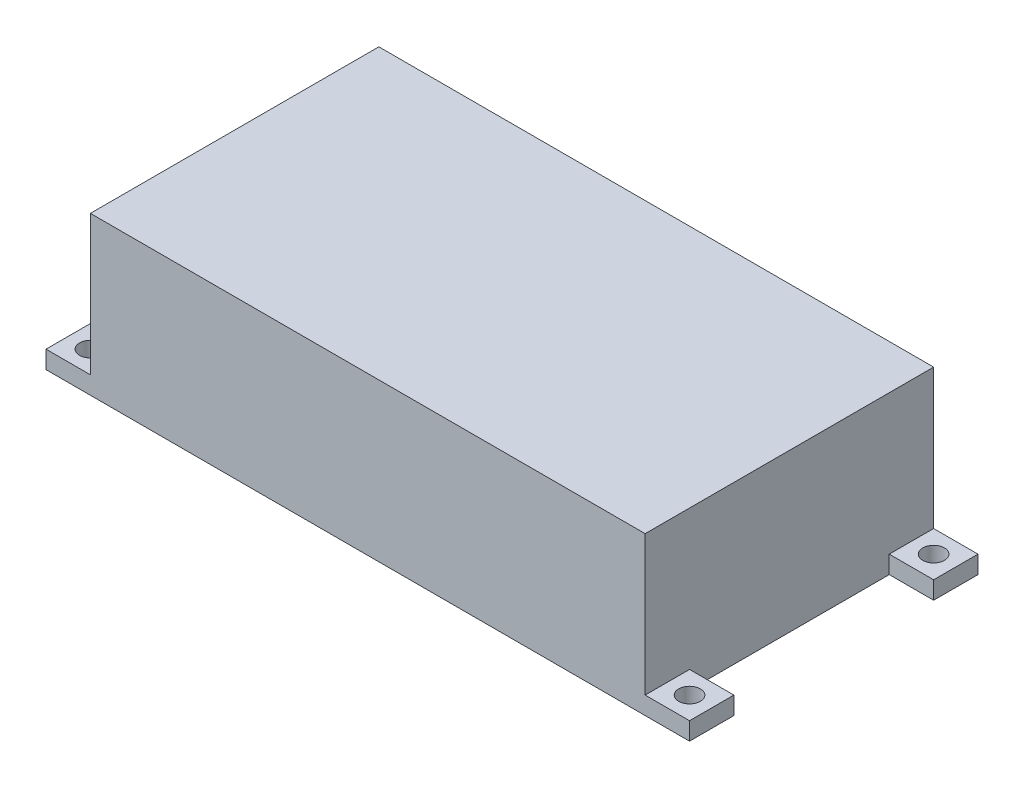
from build123d import *

# Parameters (mm, degrees)
SKETCH1_W           = 79.375
SKETCH1_H           = 41.275
SKETCH1_W_2         = 76.2
SKETCH1_H_2         = 38.1
BOSS_EXTRUDE1_DEPTH = 20.955
SKETCH2_W           = 79.375
SKETCH2_H           = 41.275
BOSS_EXTRUDE2_DEPTH = 1.5875
SKETCH3_W           = 6.35
SKETCH3_H           = 6.35
SKETCH3_R           = 1.55
BOSS_EXTRUDE3_DEPTH = 2.54
SKETCH4_W           = 8.89
SKETCH4_H           = 1.5875
CUT_EXTRUDE1_DEPTH  = 20.955
BOSS_EXTRUDE4_REACH = 97.72
SKETCH5_W           = 1.5875
SKETCH5_H           = 1.5875


with BuildPart() as part:
    # Sketch1 → Boss-Extrude1 (new body)
    with BuildSketch(Plane(origin=(0, 0, 0), x_dir=(1, 0, 0), z_dir=(0, 1, 0))):
        with Locations((38.1, 19.05)):
            Rectangle(SKETCH1_W, SKETCH1_H)
        with Locations((38.1, 19.05)):
            Rectangle(SKETCH1_W_2, SKETCH1_H_2, mode=Mode.SUBTRACT)
    extrude(amount=BOSS_EXTRUDE1_DEPTH)

    # Sketch2 → Boss-Extrude2 (add)
    with BuildSketch(Plane(origin=(0, 20.955, 0), x_dir=(1, 0, 0), z_dir=(0, 1, 0))):
        with Locations((38.1, 19.05)):
            Rectangle(SKETCH2_W, SKETCH2_H)
    extrude(amount=BOSS_EXTRUDE2_DEPTH)

    # Sketch3 → Boss-Extrude3 (add)
    # profile 1 of 4: a face of its own
    with BuildSketch(Plane.XZ):
        with Locations((80.9625, -36.5125)):
            Rectangle(SKETCH3_W, SKETCH3_H)
        with Locations(Location((80.9625, -36.5125, 0), (0, 0, 270))):
            Circle(SKETCH3_R, mode=Mode.SUBTRACT)
    # profile 2 of 4: a face of its own
    with BuildSketch(Plane.XZ):
        with Locations((80.9625, -1.5875)):
            Rectangle(SKETCH3_W, SKETCH3_H)
        with Locations(Location((80.9625, -1.5875, 0), (0, 0, 90))):
            Circle(SKETCH3_R, mode=Mode.SUBTRACT)
    # profile 3 of 4: a face of its own
    with BuildSketch(Plane.XZ):
        with Locations((-4.7625, -1.5875)):
            Rectangle(SKETCH3_W, SKETCH3_H)
        with Locations(Location((-4.7625, -1.5875, 0), (0, 0, 270))):
            Circle(SKETCH3_R, mode=Mode.SUBTRACT)
    # profile 4 of 4: a face of its own
    with BuildSketch(Plane.XZ):
        with Locations((-4.7625, -36.5125)):
            Rectangle(SKETCH3_W, SKETCH3_H)
        with Locations(Location((-4.7625, -36.5125, 0), (0, 0, 90))):
            Circle(SKETCH3_R, mode=Mode.SUBTRACT)
    extrude(amount=-BOSS_EXTRUDE3_DEPTH)

    # Sketch4 → Cut-Extrude1 (cut)
    with BuildSketch(Plane.XZ):
        with Locations((2.8575, -38.89375)):
            Rectangle(SKETCH4_W, SKETCH4_H)
    extrude(amount=-CUT_EXTRUDE1_DEPTH, mode=Mode.SUBTRACT)

    # Sketch5 → Boss-Extrude4 (add, up to next)
    with BuildSketch(Plane.XZ, mode=Mode.PRIVATE) as boss_extrude4_sk1:
        with Locations((-0.79375, -38.89375)):
            Rectangle(SKETCH5_W, SKETCH5_H)
    boss_extrude4_tool1 = extrude(boss_extrude4_sk1.sketch, amount=-BOSS_EXTRUDE4_REACH, mode=Mode.PRIVATE) - part.part
    add(boss_extrude4_tool1.solids().sort_by_distance((-0.79375, 0, -38.89375))[0])


solid = part.part
